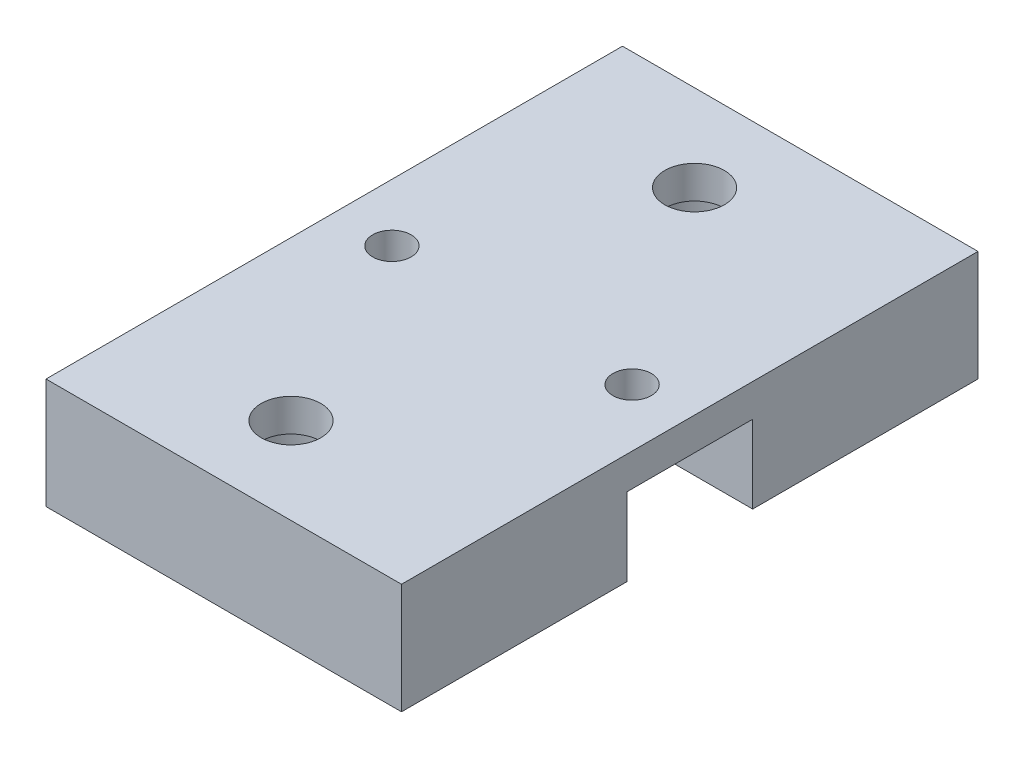
from build123d import *

# Parameters (mm, degrees)
SKETCH7_W            = 37
SKETCH7_H            = 60
SKETCH7_R            = 3.1
SKETCH7_R_2          = 2
BOSS_EXTRUDE10_DEPTH = 3.4
SKETCH8_W            = 37
SKETCH8_H            = 23.45
SKETCH8_R            = 5.5
BOSS_EXTRUDE12_DEPTH = 8.1


with BuildPart() as part:
    # Sketch7 → Boss-Extrude10 (new body)
    with BuildSketch(Plane(origin=(0, 0, 0), x_dir=(1, 0, 0), z_dir=(0, 1, 0))):
        with Locations((43.5, 0)):
            Rectangle(SKETCH7_W, SKETCH7_H)
        with Locations(Location((41.5, 21, 0), (0, 0, 270))):
            Circle(SKETCH7_R, mode=Mode.SUBTRACT)
        with Locations(Location((41.5, -21, 0), (0, 0, 90))):
            Circle(SKETCH7_R, mode=Mode.SUBTRACT)
        with Locations(Location((56, 0, 0), (0, 0, 270))):
            Circle(SKETCH7_R_2, mode=Mode.SUBTRACT)
        with Locations(Location((31, 0, 0), (0, 0, 270))):
            Circle(SKETCH7_R_2, mode=Mode.SUBTRACT)
    extrude(amount=BOSS_EXTRUDE10_DEPTH)

    # Sketch8 → Boss-Extrude12 (add)
    # profile 1 of 2: a face of its own
    with BuildSketch(Plane.XZ):
        with Locations((43.5, 18.275)):
            Rectangle(SKETCH8_W, SKETCH8_H)
        with Locations(Location((41.5, 21, 0), (0, 0, 270))):
            Circle(SKETCH8_R, mode=Mode.SUBTRACT)
    # profile 2 of 2: a face of its own
    with BuildSketch(Plane.XZ):
        with Locations((43.5, -18.275)):
            Rectangle(SKETCH8_W, SKETCH8_H)
        with Locations(Location((41.5, -21, 0), (0, 0, 90))):
            Circle(SKETCH8_R, mode=Mode.SUBTRACT)
    extrude(amount=BOSS_EXTRUDE12_DEPTH)


solid = part.part
